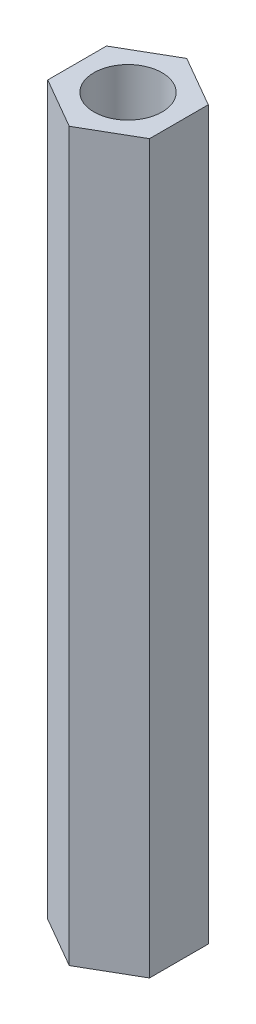
from build123d import *

# Parameters (mm, degrees)
SKETCH1_R           = 1.190625
BOSS_EXTRUDE1_DEPTH = 25.4


with BuildPart() as part:
    # Sketch1 → Boss-Extrude1 (new body)
    with BuildSketch(Plane(origin=(0, 0, 0), x_dir=(1, 0, 0), z_dir=(0, 1, 0))):
        Polygon((0, -2.053057557), (1.778, -1.026528779), (1.778, 1.026528779), (0, 2.053057557), (-1.778, 1.026528779), (-1.778, -1.026528779), align=None)
        with Locations(Location((0, 0, 0), (0, 0, 270))):
            Circle(SKETCH1_R, mode=Mode.SUBTRACT)
    extrude(amount=BOSS_EXTRUDE1_DEPTH)


solid = part.part
